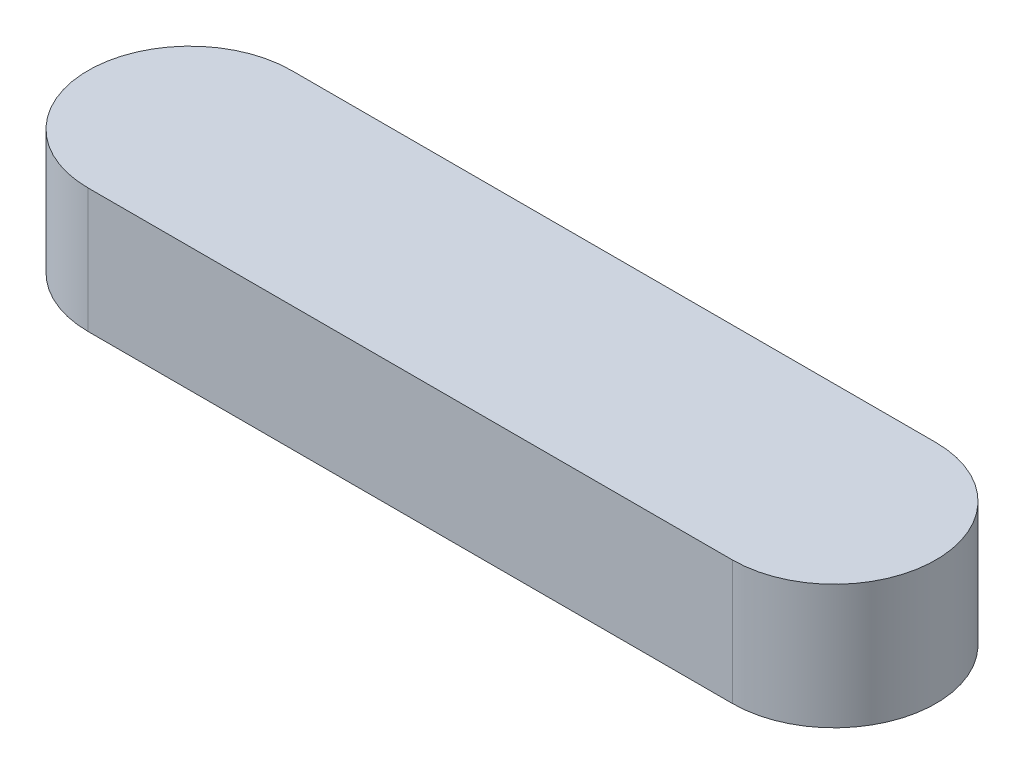
from build123d import *

# Parameters (mm, degrees)
EXTRUDE_1_DEPTH = 11


with BuildPart() as part:
    # ｽｹｯﾁ1 → ﾎﾞｽ - 押し出し1 (new body)
    with BuildSketch(Plane(origin=(0, 0, 0), x_dir=(1, 0, 0), z_dir=(0, 1, 0))):
        with BuildLine():
            Line((0, 9), (57, 9))
            ThreePointArc((57, 9), (66, 0), (57, -9))
            Line((57, -9), (0, -9))
            ThreePointArc((0, -9), (-9, 0), (0, 9))
        make_face()
    extrude(amount=EXTRUDE_1_DEPTH)


solid = part.part
